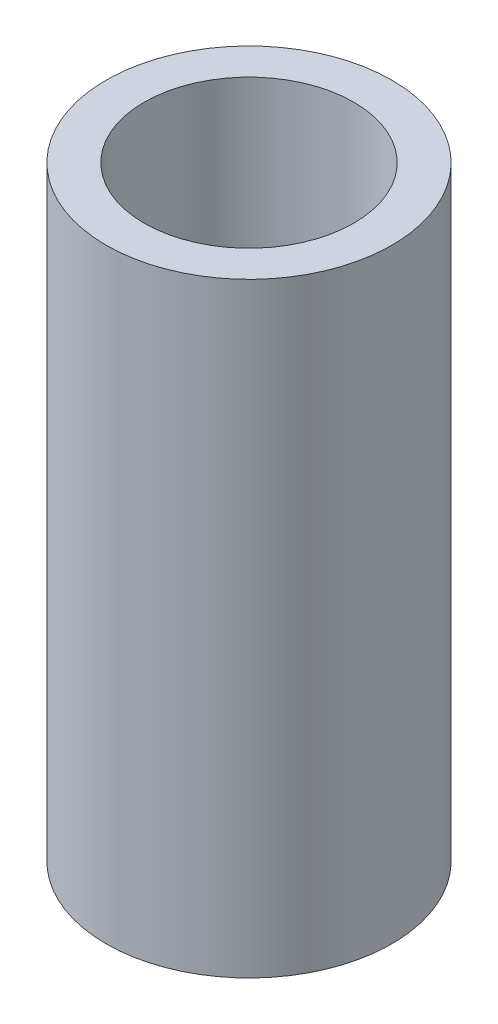
from build123d import *

# Parameters (mm, degrees)
SKETCH1_R           = 1.5
BOSS_EXTRUDE1_DEPTH = 6.35
SKETCH2_R           = 1.1
CUT_EXTRUDE1_DEPTH  = 6.35


with BuildPart() as part:
    # Sketch1 → Boss-Extrude1 (new body)
    with BuildSketch(Plane(origin=(-40.828554295, 6.547397554, -7.314120173), x_dir=(1, 0, 0), z_dir=(0, 1, 0))):
        with Locations(Location((9.676951905, 16.739927597, 0), (0, 0, 270))):
            Circle(SKETCH1_R)
    extrude(amount=BOSS_EXTRUDE1_DEPTH)

    # Sketch2 → Cut-Extrude1 (cut)
    with BuildSketch(Plane(origin=(0, 6.547397554, 0), x_dir=(-1, 0, 0), z_dir=(0, -1, 0))):
        with Locations(Location((31.151602389, 24.054047769, 0), (0, 0, 90))):
            Circle(SKETCH2_R)
    extrude(amount=-CUT_EXTRUDE1_DEPTH, mode=Mode.SUBTRACT)


solid = part.part
